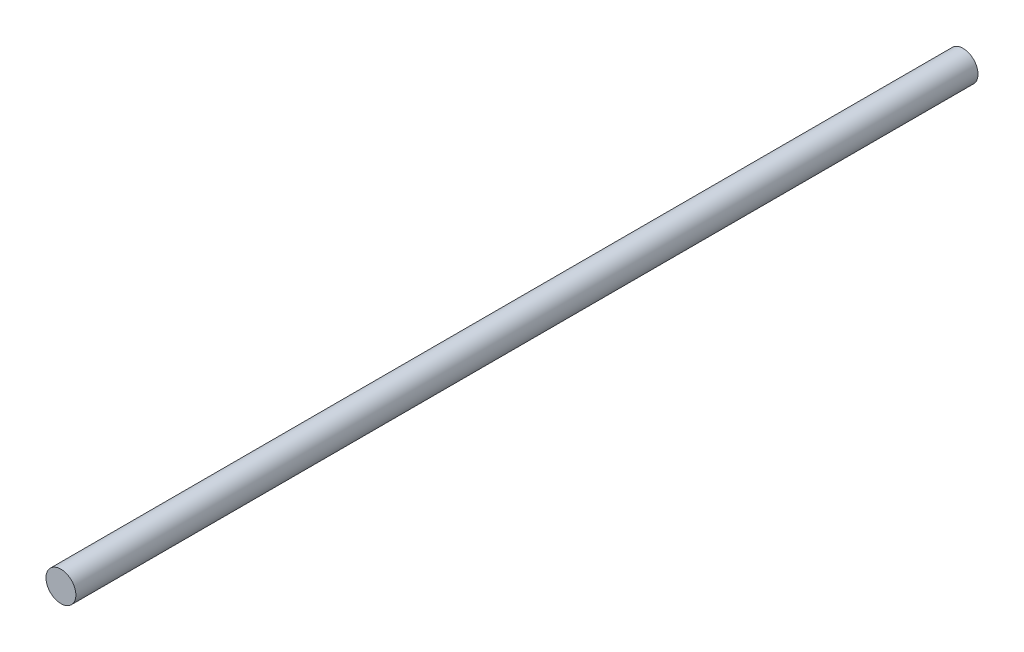
from build123d import *

# Parameters (mm, degrees)
SKETCH_1_R           = 2
CABLE_ENVELOPE_DEPTH = 120.701750194


with BuildPart() as part:
    # 草图1 → Cable_envelope (new body)
    with BuildSketch(Plane.XY):
        Circle(SKETCH_1_R)
    extrude(amount=CABLE_ENVELOPE_DEPTH)


solid = part.part
